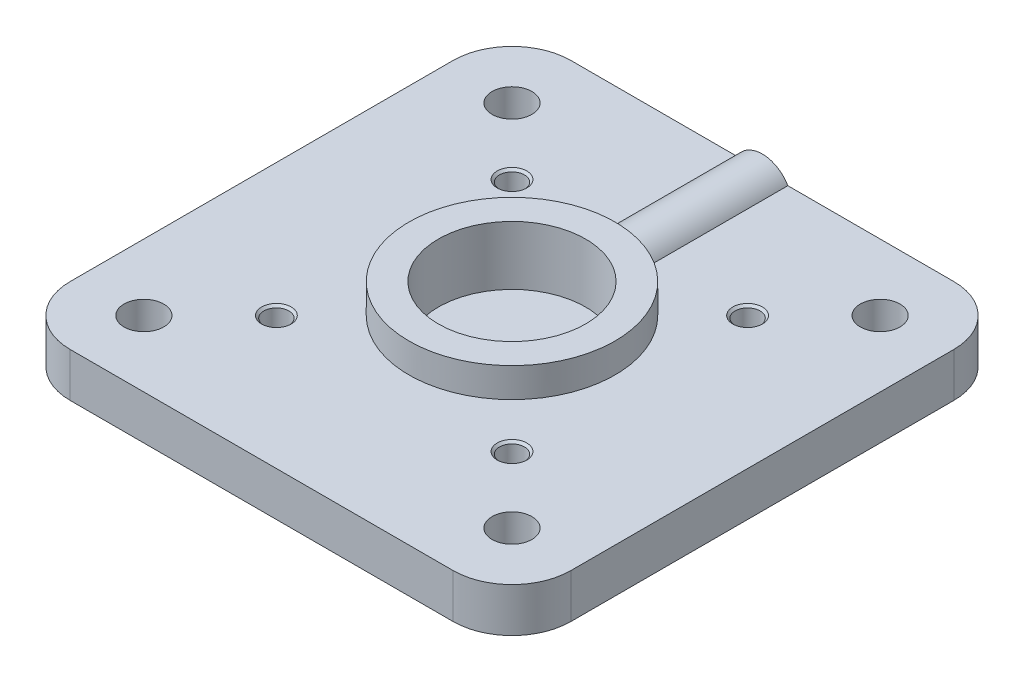
from build123d import *

# Parameters (mm, degrees)
EXTRUDE_1_DEPTH      = 15
SKETCH_2_R           = 35
EXTRUDE_2_DEPTH      = 10
SKETCH_3_R           = 65
SKETCH_3_R_2         = 50
EXTRUDE_3_DEPTH      = 10
SKETCH_4_R           = 25
CUT_EXTRUDE_1_DEPTH  = 20
CUT_EXTRUDE_2_REACH  = 124.78
SKETCH_5_R           = 6.75
EXTRUDE_4_REACH      = 193.703
EXTRUDE_4_END_RADIUS = 35
SKETCH_9_R           = 10
SKETCH_11_R          = 3
SKETCH_10_R          = 6
SKETCH_12_R          = 3
CUT_EXTRUDE_4_DEPTH  = 33
SKETCH_13_R          = 3
CUT_EXTRUDE_5_DEPTH  = 13
EXTRUDE_START        = 6
EXTRUDE_5_DEPTH      = 6
EXTRUDE_6_DEPTH      = 13
M10X1_52_D           = 8.5
M10X1_52_DEPTH       = 18
M10X1_52_CSINK_D     = 10.05
M10X1_52_CSINK_ANGLE = 90
M10X1_52_TIP         = 2.553657631


with BuildPart() as part:
    # Эскиз1 → Бобышка-Вытянуть1 (new body)
    with BuildSketch(Plane(origin=(0, 0, 0), x_dir=(1, 0, 0), z_dir=(0, 1, 0))):
        with BuildLine():
            Line((-65, -85), (65, -85))
            ThreePointArc((65, -85), (79.142135624, -79.142135624), (85, -65))
            Line((85, -65), (85, 65))
            ThreePointArc((85, 65), (79.142135624, 79.142135624), (65, 85))
            Line((65, 85), (-65, 85))
            ThreePointArc((-65, 85), (-79.142135624, 79.142135624), (-85, 65))
            Line((-85, 65), (-85, -65))
            ThreePointArc((-85, -65), (-79.142135624, -79.142135624), (-65, -85))
        make_face()
    extrude(amount=EXTRUDE_1_DEPTH)

    # Эскиз2 → Бобышка-Вытянуть2 (add)
    with BuildSketch(Plane(origin=(0, 15, 0), x_dir=(1, 0, 0), z_dir=(0, 1, 0))):
        with Locations(Location((0, 0, 0), (0, 0, 270))):
            Circle(SKETCH_2_R)
    extrude(amount=EXTRUDE_2_DEPTH)

    # Эскиз3 → Бобышка-Вытянуть3 (add)
    with BuildSketch(Plane.XZ):
        with Locations(Location((0, 0, 0), (0, 0, 90))):
            Circle(SKETCH_3_R)
        with Locations(Location((0, 0, 0), (0, 0, 270))):
            Circle(SKETCH_3_R_2, mode=Mode.SUBTRACT)
    extrude(amount=EXTRUDE_3_DEPTH)

    # Эскиз4 → Вырез-Вытянуть1 (cut)
    with BuildSketch(Plane(origin=(0, 25, 0), x_dir=(1, 0, 0), z_dir=(0, 1, 0))):
        with Locations(Location((0, 0, 0), (0, 0, 270))):
            Circle(SKETCH_4_R)
    extrude(amount=-CUT_EXTRUDE_1_DEPTH, mode=Mode.SUBTRACT)

    # Эскиз5 → Вырез-Вытянуть2 (cut, up to next)
    with BuildSketch(Plane(origin=(0, 15, 0), x_dir=(1, 0, 0), z_dir=(0, 1, 0)), mode=Mode.PRIVATE) as cut_extrude_2_sk1:
        with Locations(Location((-62.5, 62.5, 0), (0, 0, 270))):
            Circle(SKETCH_5_R)
    cut_extrude_2_tool1 = extrude(cut_extrude_2_sk1.sketch, amount=-CUT_EXTRUDE_2_REACH, mode=Mode.PRIVATE) & part.part
    # Эскиз5 → Вырез-Вытянуть2 (cut, up to next)
    with BuildSketch(Plane(origin=(0, 15, 0), x_dir=(1, 0, 0), z_dir=(0, 1, 0)), mode=Mode.PRIVATE) as cut_extrude_2_sk2:
        with Locations(Location((62.5, 62.5, 0), (0, 0, 270))):
            Circle(SKETCH_5_R)
    cut_extrude_2_tool2 = extrude(cut_extrude_2_sk2.sketch, amount=-CUT_EXTRUDE_2_REACH, mode=Mode.PRIVATE) & part.part
    # Эскиз5 → Вырез-Вытянуть2 (cut, up to next)
    with BuildSketch(Plane(origin=(0, 15, 0), x_dir=(1, 0, 0), z_dir=(0, 1, 0)), mode=Mode.PRIVATE) as cut_extrude_2_sk3:
        with Locations(Location((62.5, -62.5, 0), (0, 0, 270))):
            Circle(SKETCH_5_R)
    cut_extrude_2_tool3 = extrude(cut_extrude_2_sk3.sketch, amount=-CUT_EXTRUDE_2_REACH, mode=Mode.PRIVATE) & part.part
    # Эскиз5 → Вырез-Вытянуть2 (cut, up to next)
    with BuildSketch(Plane(origin=(0, 15, 0), x_dir=(1, 0, 0), z_dir=(0, 1, 0)), mode=Mode.PRIVATE) as cut_extrude_2_sk4:
        with Locations(Location((-62.5, -62.5, 0), (0, 0, 270))):
            Circle(SKETCH_5_R)
    cut_extrude_2_tool4 = extrude(cut_extrude_2_sk4.sketch, amount=-CUT_EXTRUDE_2_REACH, mode=Mode.PRIVATE) & part.part
    add(cut_extrude_2_tool1.solids().sort_by_distance((-62.5, 15, -62.5))[0], mode=Mode.SUBTRACT)
    add(cut_extrude_2_tool2.solids().sort_by_distance((62.5, 15, -62.5))[0], mode=Mode.SUBTRACT)
    add(cut_extrude_2_tool3.solids().sort_by_distance((62.5, 15, 62.5))[0], mode=Mode.SUBTRACT)
    add(cut_extrude_2_tool4.solids().sort_by_distance((-62.5, 15, 62.5))[0], mode=Mode.SUBTRACT)

    # Бобышка-Вытянуть4: up to this cylinder (the profile starts outside it)
    extrude_4_end = Plane(origin=(0, 10, 0), z_dir=(0, -1, 0)) * Cylinder(EXTRUDE_4_END_RADIUS, 458.406, mode=Mode.PRIVATE)
    # Эскиз9 → Бобышка-Вытянуть4 (add, up to the surface)
    with BuildSketch(Plane(origin=(0, 0, -85), x_dir=(-1, 0, 0), z_dir=(0, 0, -1)), mode=Mode.PRIVATE) as extrude_4_sk1:
        with Locations((0, 10)):
            Circle(SKETCH_9_R)
    extrude_4_tool1 = extrude(extrude_4_sk1.sketch, amount=-EXTRUDE_4_REACH, mode=Mode.PRIVATE) - extrude_4_end
    add(extrude_4_tool1.solids().sort_by_distance((0, 10, -85))[0])

    # Эскиз11 → Вырез-По сечениям1 section 0
    with BuildSketch(Plane(origin=(0, 0, -73), x_dir=(-1, 0, 0), z_dir=(0, 0, -1))):
        with Locations((0, 10)):
            Circle(SKETCH_11_R)
    # Эскиз10 → Вырез-По сечениям1 section 1
    with BuildSketch(Plane(origin=(0, 0, -85), x_dir=(-1, 0, 0), z_dir=(0, 0, -1))):
        with Locations((0, 10)):
            Circle(SKETCH_10_R)
    loft(mode=Mode.SUBTRACT)

    # Эскиз12 → Вырез-Вытянуть4 (cut)
    with BuildSketch(Plane(origin=(0, 0, -73), x_dir=(-1, 0, 0), z_dir=(0, 0, -1))):
        with Locations((0, 10)):
            Circle(SKETCH_12_R)
    extrude(amount=-CUT_EXTRUDE_4_DEPTH, mode=Mode.SUBTRACT)

    # Эскиз13 → Вырез-Вытянуть5 (cut)
    with BuildSketch(Plane.XZ):
        with Locations(Location((0, -43, 0), (0, 0, 270))):
            Circle(SKETCH_13_R)
    extrude(amount=-CUT_EXTRUDE_5_DEPTH, mode=Mode.SUBTRACT)

    # Эскиз14 → Бобышка-Вытянуть5 (add)
    with BuildSketch(Plane(origin=(0, 0, -40), x_dir=(-1, 0, 0), z_dir=(0, 0, -1)).offset(EXTRUDE_START)):
        with BuildLine():
            Line((3, 10), (4.5, 10))
            ThreePointArc((4.5, 10), (0, 14.5), (-4.5, 10))
            Line((-4.5, 10), (-3, 10))
            ThreePointArc((-3, 10), (0, 13), (3, 10))
        make_face()
    extrude(amount=-EXTRUDE_5_DEPTH)

    # Эскиз15 → Бобышка-Вытянуть6 (add)
    with BuildSketch(Plane.XZ):
        with BuildLine():
            Line((-3, -43), (-4.5, -43))
            ThreePointArc((-4.5, -43), (0, -38.5), (4.5, -43))
            Line((4.5, -43), (3, -43))
            ThreePointArc((3, -43), (0, -40), (-3, -43))
        make_face()
    extrude(amount=-EXTRUDE_6_DEPTH)

    # Отверстие обработанное метчиком M10x1.52
    with Locations(Plane(origin=(-40, 15, -40), x_dir=(0, 0, 1), z_dir=(0, 1, 0))):
        with Locations((0, 0), (0, 80), (80, 80), (80, 0)):
            CounterSinkHole(M10X1_52_D / 2, M10X1_52_CSINK_D / 2, depth=M10X1_52_DEPTH, counter_sink_angle=M10X1_52_CSINK_ANGLE)
            with Locations((0, 0, -(M10X1_52_DEPTH + M10X1_52_TIP / 2))):  # 118° drill point
                Cone(0, M10X1_52_D / 2, M10X1_52_TIP, mode=Mode.SUBTRACT)


solid = part.part
